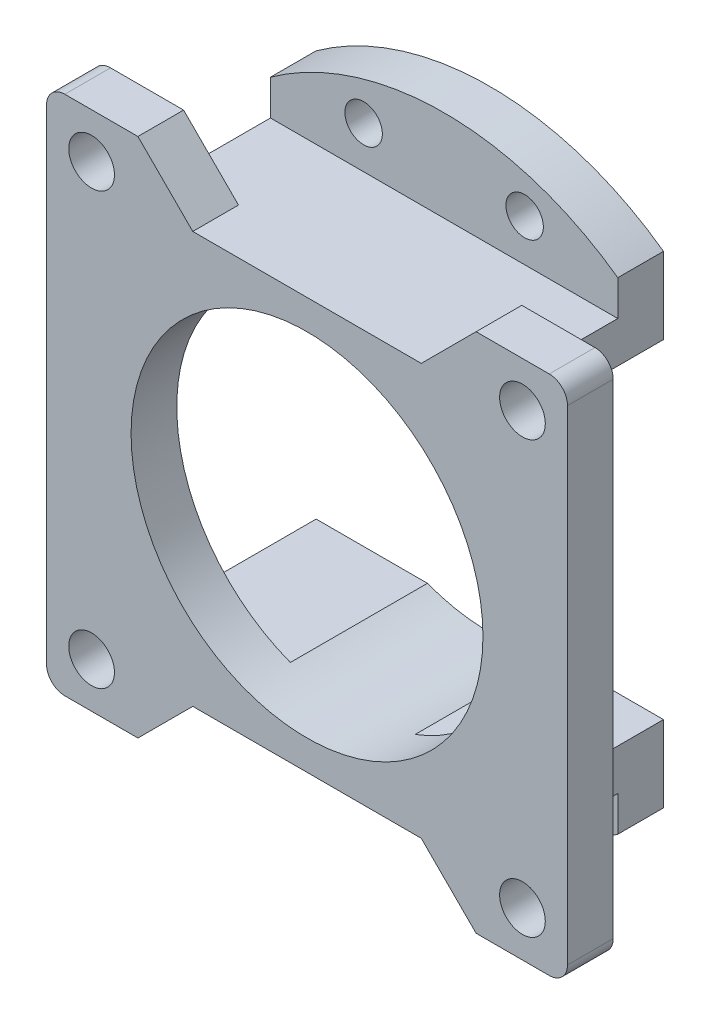
from build123d import *

# Parameters (mm, degrees)
SKETCH1_W           = 38
SKETCH1_H           = 36
SKETCH1_R           = 1.55
SKETCH1_R_2         = 11.5
BOSS_EXTRUDE1_DEPTH = 5
SKETCH2_W           = 38
SKETCH2_H           = 4.5
BOSS_EXTRUDE2_DEPTH = 20
SKETCH3_R           = 2.05
BOSS_EXTRUDE3_DEPTH = 5
BOSS_EXTRUDE4_START = -5
SKETCH4_W           = 57
SKETCH4_H           = 57
SKETCH4_R           = 2.5
SKETCH4_W_2         = 38
SKETCH4_H_2         = 45
SKETCH4_R_2         = 1.55
SKETCH4_R_3         = 11.5
BOSS_EXTRUDE4_DEPTH = 5
FILLET2_R           = 2
SKETCH6_R           = 19.25
CUT_EXTRUDE2_DEPTH  = 48.628772816
CUT_EXTRUDE3_DEPTH  = 5


with BuildPart() as part:
    # Sketch1 → Boss-Extrude1 (new body)
    with BuildSketch(Plane.XY):
        Rectangle(SKETCH1_W, SKETCH1_H)
        with Locations((15.5, 15.5)):
            Circle(SKETCH1_R, mode=Mode.SUBTRACT)
        with Locations((-15.5, 15.5)):
            Circle(SKETCH1_R, mode=Mode.SUBTRACT)
        with Locations((15.5, -15.5)):
            Circle(SKETCH1_R, mode=Mode.SUBTRACT)
        with Locations((-15.5, -15.5)):
            Circle(SKETCH1_R, mode=Mode.SUBTRACT)
        Circle(SKETCH1_R_2, mode=Mode.SUBTRACT)
    extrude(amount=BOSS_EXTRUDE1_DEPTH)

    # Sketch2 → Boss-Extrude2 (add)
    with BuildSketch(Plane.XY.offset(5)):
        with Locations((0, 20.25)):
            Rectangle(SKETCH2_W, SKETCH2_H)
        with Locations((0, -20.25)):
            Rectangle(SKETCH2_W, SKETCH2_H)
    extrude(amount=-BOSS_EXTRUDE2_DEPTH)

    # Sketch3 → Boss-Extrude3 (add)
    # profile 1 of 2: a face of its own
    with BuildSketch(Plane(origin=(0, 0, -15), x_dir=(-1, 0, 0), z_dir=(0, 0, -1))):
        with BuildLine():
            Line((-19, 26.367593747), (-19, 22.5))
            Line((-19, 22.5), (19, 22.5))
            Line((19, 22.5), (19, 26.367593747))
            ThreePointArc((19, 26.367593747), (9.982564879, 30.928924948), (-6e-09, 32.5))
            ThreePointArc((-6e-09, 32.5), (-9.982564884, 30.928924946), (-19, 26.367593747))
        make_face()
        with Locations((-8.80698434, 27.105110714)):
            Circle(SKETCH3_R, mode=Mode.SUBTRACT)
        with Locations((8.80698434, 27.105110714)):
            Circle(SKETCH3_R, mode=Mode.SUBTRACT)
    # profile 2 of 2: a face of its own
    with BuildSketch(Plane(origin=(0, 0, -15), x_dir=(-1, 0, 0), z_dir=(0, 0, -1))):
        with BuildLine():
            Line((-19, -22.5), (-19, -26.367593747))
            ThreePointArc((-19, -26.367593747), (-9.982564919, -30.928924935), (-7.8e-08, -32.5))
            ThreePointArc((-7.8e-08, -32.5), (9.982564844, -30.928924959), (19, -26.367593747))
            Line((19, -26.367593747), (19, -22.5))
            Line((19, -22.5), (-19, -22.5))
        make_face()
        with Locations((-8.80698434, -27.105110714)):
            Circle(SKETCH3_R, mode=Mode.SUBTRACT)
        with Locations((8.80698434, -27.105110714)):
            Circle(SKETCH3_R, mode=Mode.SUBTRACT)
    extrude(amount=-BOSS_EXTRUDE3_DEPTH)

    # Sketch4 → Boss-Extrude4 (add)
    # profile 1 of 6: a face of its own
    with BuildSketch(Plane.XY.offset(5).offset(BOSS_EXTRUDE4_START)):
        Rectangle(SKETCH4_W, SKETCH4_H)
        with Locations((-23.57, -23.57)):
            Circle(SKETCH4_R, mode=Mode.SUBTRACT)
        with Locations((23.57, -23.57)):
            Circle(SKETCH4_R, mode=Mode.SUBTRACT)
        Rectangle(SKETCH4_W_2, SKETCH4_H_2, mode=Mode.SUBTRACT)
        with Locations((-23.57, 23.57)):
            Circle(SKETCH4_R, mode=Mode.SUBTRACT)
        with Locations((23.57, 23.57)):
            Circle(SKETCH4_R, mode=Mode.SUBTRACT)
    # profile 2 of 6: a face of its own
    with BuildSketch(Plane.XY.offset(5).offset(BOSS_EXTRUDE4_START)):
        Rectangle(SKETCH4_W_2, SKETCH4_H_2)
        with Locations((-15.5, -15.5)):
            Circle(SKETCH4_R_2, mode=Mode.SUBTRACT)
        Circle(SKETCH4_R_3, mode=Mode.SUBTRACT)
        with Locations((15.5, -15.5)):
            Circle(SKETCH4_R_2, mode=Mode.SUBTRACT)
        with Locations((-15.5, 15.5)):
            Circle(SKETCH4_R_2, mode=Mode.SUBTRACT)
        with Locations((15.5, 15.5)):
            Circle(SKETCH4_R_2, mode=Mode.SUBTRACT)
    # profile 3 of 6: a face of its own
    with BuildSketch(Plane.XY.offset(5).offset(BOSS_EXTRUDE4_START)):
        with Locations((-15.5, 15.5)):
            Circle(SKETCH4_R_2)
    # profile 4 of 6: a face of its own
    with BuildSketch(Plane.XY.offset(5).offset(BOSS_EXTRUDE4_START)):
        with Locations((-15.5, -15.5)):
            Circle(SKETCH4_R_2)
    # profile 5 of 6: a face of its own
    with BuildSketch(Plane.XY.offset(5).offset(BOSS_EXTRUDE4_START)):
        with Locations((15.5, -15.5)):
            Circle(SKETCH4_R_2)
    # profile 6 of 6: a face of its own
    with BuildSketch(Plane.XY.offset(5).offset(BOSS_EXTRUDE4_START)):
        with Locations((15.5, 15.5)):
            Circle(SKETCH4_R_2)
    extrude(amount=BOSS_EXTRUDE4_DEPTH)

    # Fillet2
    fillet2_edges = [part.edges().sort_by_distance(p)[0] for p in [
        (28.5, -28.5, 2.5),
        (-28.5, -28.5, 2.5),
        (-28.5, 28.5, 2.5),
        (28.5, 28.5, 2.5),
    ]]
    fillet(fillet2_edges, radius=FILLET2_R)

    # Sketch6 → Cut-Extrude2 (cut, through all)
    with BuildSketch(Plane.XY.offset(5)):
        Circle(SKETCH6_R)
    extrude(amount=-CUT_EXTRUDE2_DEPTH, mode=Mode.SUBTRACT)

    # Sketch7 → Cut-Extrude3 (cut)
    with BuildSketch(Plane.XY.offset(5)):
        Polygon((18.5, 28.5), (-18.5, 28.5), (-12.5, 22.5), (12.5, 22.5), align=None)
        Polygon((-12.5, -22.5), (-18.5, -28.5), (18.5, -28.5), (12.5, -22.5), align=None)
    extrude(amount=-CUT_EXTRUDE3_DEPTH, mode=Mode.SUBTRACT)


solid = part.part
